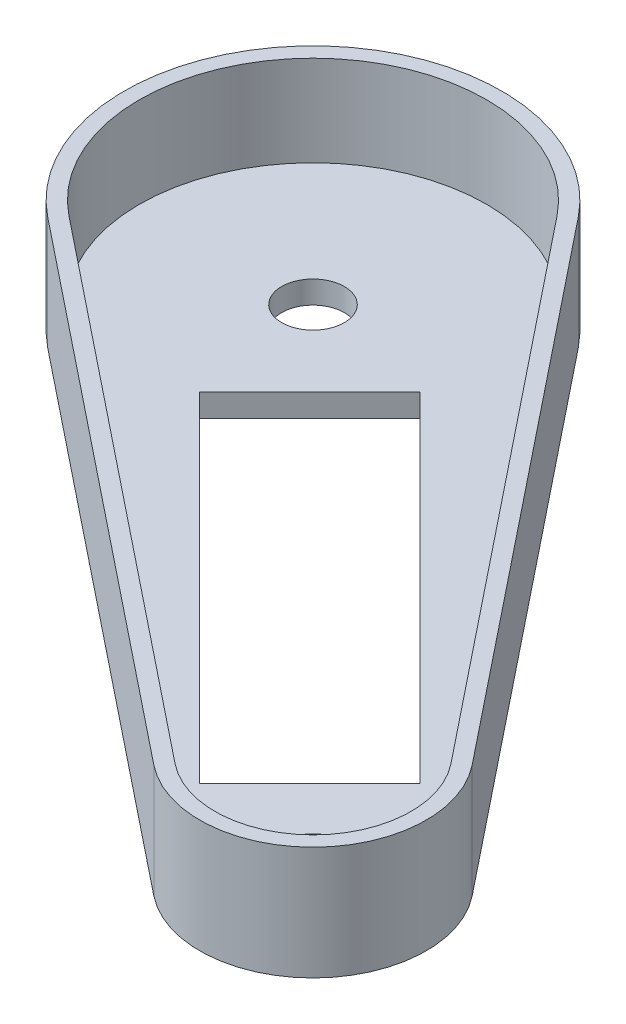
from build123d import *

# Parameters (mm, degrees)
SKETCH_1_R          = 4.15
EXTRUDE_1_DEPTH     = 3
EXTRUDE_2_DEPTH     = 12
CUT_EXTRUDE_1_DEPTH = 112.858735101


with BuildPart() as part:
    # 草图1 → 凸台-拉伸1 (new body)
    with BuildSketch(Plane(origin=(0, 0, 0), x_dir=(1, 0, 0), z_dir=(0, 1, 0))):
        with BuildLine():
            ThreePointArc((19.532394726, 15.60402372), (-17.67766953, 17.67766953), (-15.60402372, -19.532394726))
            Line((-15.60402372, -19.532394726), (54.277196075, -75.359047143))
            ThreePointArc((54.277196075, -75.359047143), (74.246212025, -74.246212025), (75.359047143, -54.277196075))
            Line((75.359047143, -54.277196075), (19.532394726, 15.60402372))
        make_face()
        with Locations(Location((0, 0, 0), (0, 0, 270))):
            Circle(SKETCH_1_R, mode=Mode.SUBTRACT)
        with Locations(Location((63.639610307, -63.639610307, 0), (0, 0, 270))):
            Circle(SKETCH_1_R, mode=Mode.SUBTRACT)
    extrude(amount=EXTRUDE_1_DEPTH)

    # 草图3 → 凸台-拉伸2 (add)
    with BuildSketch(Plane(origin=(0, 3, 0), x_dir=(1, 0, 0), z_dir=(0, 1, 0))):
        with BuildLine():
            ThreePointArc((54.277196075, -75.359047143), (74.246212025, -74.246212025), (75.359047143, -54.277196075))
            Line((75.359047143, -54.277196075), (19.532394726, 15.60402372))
            ThreePointArc((19.532394726, 15.60402372), (-17.67766953, 17.67766953), (-15.60402372, -19.532394726))
            Line((-15.60402372, -19.532394726), (54.277196075, -75.359047143))
        make_face()
        with BuildLine():
            Line((17.969803148, 14.355701822), (73.796455565, -55.525517972))
            ThreePointArc((73.796455565, -55.525517972), (72.831998462, -72.831998462), (55.525517972, -73.796455565))
            Line((55.525517972, -73.796455565), (-14.355701822, -17.969803148))
            ThreePointArc((-14.355701822, -17.969803148), (-16.263455967, 16.263455967), (17.969803148, 14.355701822))
        make_face(mode=Mode.SUBTRACT)
    extrude(amount=EXTRUDE_2_DEPTH)

    # 草图4 → 切除-拉伸1 (cut, through all)
    with BuildSketch(Plane(origin=(0, 3, 0), x_dir=(1, 0, 0), z_dir=(0, 1, 0))):
        Polygon((17.133662373, -2.976992155), (10.055327264, -10.055327264), (54.909619217, -54.909619217), (61.987954325, -47.831284108), align=None)
        Polygon((54.909619217, -54.909619217), (10.055327264, -10.055327264), (2.529939412, -17.580715117), (47.384231364, -62.435007069), align=None)
    extrude(amount=-CUT_EXTRUDE_1_DEPTH, mode=Mode.SUBTRACT)


solid = part.part
